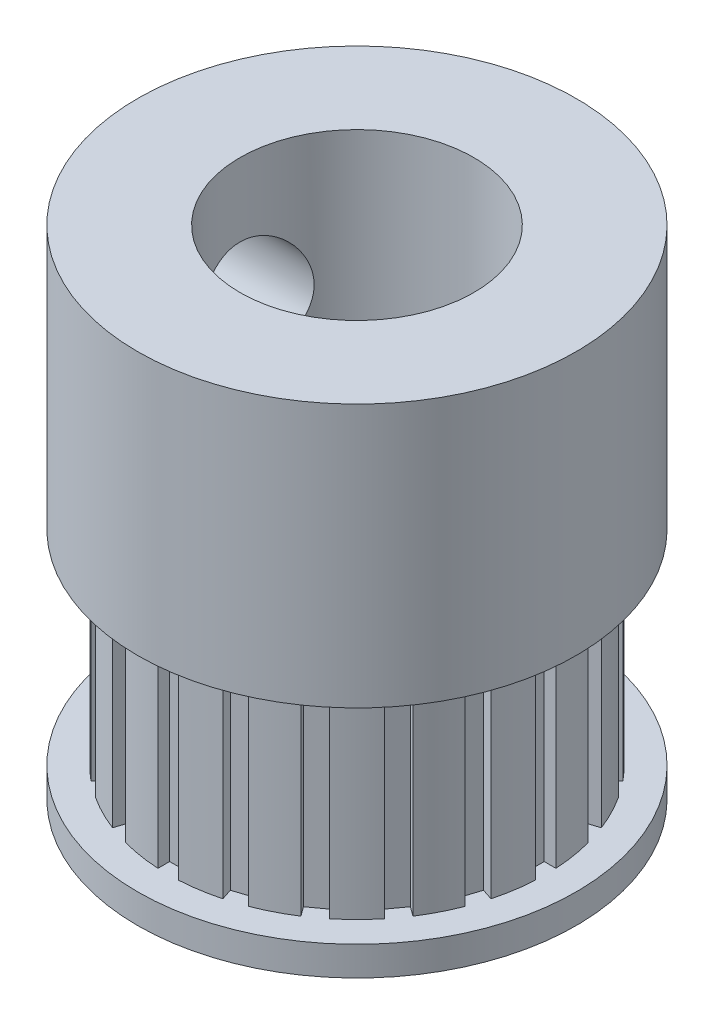
from build123d import *

# Parameters (mm, degrees)
SKETCH_1_R               = 7.5
EXTRUDE_1_DEPTH          = 1
EXTRUDE_2_DEPTH          = 7
SKETCH_3_R               = 7.5
EXTRUDE_3_DEPTH          = 9
CUT_EXTRUDE_1_REACH      = 22.037
SKETCH_4_R               = 4
CUT_EXTRUDE_2_REACH      = 22.037
CUT_EXTRUDE_2_END_RADIUS = 7.5
SKETCH_5_R               = 2


with BuildPart() as part:
    # 草图1 → 凸台-拉伸1 (new body)
    with BuildSketch(Plane(origin=(0, 0, 0), x_dir=(1, 0, 0), z_dir=(0, 1, 0))):
        with Locations(Location((0, 0, 0), (0, 0, 270))):
            Circle(SKETCH_1_R)
    extrude(amount=EXTRUDE_1_DEPTH)

    # 草图2 → 凸台-拉伸2 (add)
    with BuildSketch(Plane(origin=(0, 1, 0), x_dir=(1, 0, 0), z_dir=(0, 1, 0))):
        with BuildLine():
            Line((-0.35, 6.055518957), (-0.35, 6.455518957))
            ThreePointArc((-0.35, 6.455518957), (-1.011348816, 6.385405122), (-1.661995284, 6.247719318))
            Line((-1.661995284, 6.247719318), (-1.538388487, 5.867296711))
            Line((-1.538388487, 5.867296711), (-2.204128048, 5.650984815))
            Line((-2.204128048, 5.650984815), (-2.327734846, 6.031407422))
            ThreePointArc((-2.327734846, 6.031407422), (-2.935048581, 5.760357179), (-3.511302891, 5.428349382))
            Line((-3.511302891, 5.428349382), (-3.27618879, 5.104742584))
            Line((-3.27618879, 5.104742584), (-3.842500686, 4.693292907))
            Line((-3.842500686, 4.693292907), (-4.077614787, 5.016899705))
            ThreePointArc((-4.077614787, 5.016899705), (-4.57144534, 4.57144534), (-5.016899705, 4.077614787))
            Line((-5.016899705, 4.077614787), (-4.693292907, 3.842500686))
            Line((-4.693292907, 3.842500686), (-5.104742584, 3.27618879))
            Line((-5.104742584, 3.27618879), (-5.428349382, 3.511302891))
            ThreePointArc((-5.428349382, 3.511302891), (-5.760357179, 2.935048581), (-6.031407422, 2.327734846))
            Line((-6.031407422, 2.327734846), (-5.650984815, 2.204128048))
            Line((-5.650984815, 2.204128048), (-5.867296711, 1.538388487))
            Line((-5.867296711, 1.538388487), (-6.247719318, 1.661995284))
            ThreePointArc((-6.247719318, 1.661995284), (-6.385405122, 1.011348816), (-6.455518957, 0.35))
            Line((-6.455518957, 0.35), (-6.055518957, 0.35))
            Line((-6.055518957, 0.35), (-6.055518957, -0.35))
            Line((-6.055518957, -0.35), (-6.455518957, -0.35))
            ThreePointArc((-6.455518957, -0.35), (-6.385405122, -1.011348816), (-6.247719318, -1.661995284))
            Line((-6.247719318, -1.661995284), (-5.867296711, -1.538388487))
            Line((-5.867296711, -1.538388487), (-5.650984815, -2.204128048))
            Line((-5.650984815, -2.204128048), (-6.031407422, -2.327734846))
            ThreePointArc((-6.031407422, -2.327734846), (-5.760357179, -2.935048581), (-5.428349382, -3.511302891))
            Line((-5.428349382, -3.511302891), (-5.104742584, -3.27618879))
            Line((-5.104742584, -3.27618879), (-4.693292907, -3.842500686))
            Line((-4.693292907, -3.842500686), (-5.016899705, -4.077614787))
            ThreePointArc((-5.016899705, -4.077614787), (-4.57144534, -4.57144534), (-4.077614787, -5.016899705))
            Line((-4.077614787, -5.016899705), (-3.842500686, -4.693292907))
            Line((-3.842500686, -4.693292907), (-3.27618879, -5.104742584))
            Line((-3.27618879, -5.104742584), (-3.511302891, -5.428349382))
            ThreePointArc((-3.511302891, -5.428349382), (-2.935048581, -5.760357179), (-2.327734846, -6.031407422))
            Line((-2.327734846, -6.031407422), (-2.204128048, -5.650984815))
            Line((-2.204128048, -5.650984815), (-1.538388487, -5.867296711))
            Line((-1.538388487, -5.867296711), (-1.661995284, -6.247719318))
            ThreePointArc((-1.661995284, -6.247719318), (-1.011348816, -6.385405122), (-0.35, -6.455518957))
            Line((-0.35, -6.455518957), (-0.35, -6.055518957))
            Line((-0.35, -6.055518957), (0.35, -6.055518957))
            Line((0.35, -6.055518957), (0.35, -6.455518957))
            ThreePointArc((0.35, -6.455518957), (1.011348816, -6.385405122), (1.661995284, -6.247719318))
            Line((1.661995284, -6.247719318), (1.538388487, -5.867296711))
            Line((1.538388487, -5.867296711), (2.204128048, -5.650984815))
            Line((2.204128048, -5.650984815), (2.327734846, -6.031407422))
            ThreePointArc((2.327734846, -6.031407422), (2.935048581, -5.760357179), (3.511302891, -5.428349382))
            Line((3.511302891, -5.428349382), (3.27618879, -5.104742584))
            Line((3.27618879, -5.104742584), (3.842500686, -4.693292907))
            Line((3.842500686, -4.693292907), (4.077614787, -5.016899705))
            ThreePointArc((4.077614787, -5.016899705), (4.57144534, -4.57144534), (5.016899705, -4.077614787))
            Line((5.016899705, -4.077614787), (4.693292907, -3.842500686))
            Line((4.693292907, -3.842500686), (5.104742584, -3.27618879))
            Line((5.104742584, -3.27618879), (5.428349382, -3.511302891))
            ThreePointArc((5.428349382, -3.511302891), (5.760357179, -2.935048581), (6.031407422, -2.327734846))
            Line((6.031407422, -2.327734846), (5.650984815, -2.204128048))
            Line((5.650984815, -2.204128048), (5.867296711, -1.538388487))
            Line((5.867296711, -1.538388487), (6.247719318, -1.661995284))
            ThreePointArc((6.247719318, -1.661995284), (6.385405122, -1.011348816), (6.455518957, -0.35))
            Line((6.455518957, -0.35), (6.055518957, -0.35))
            Line((6.055518957, -0.35), (6.055518957, 0.35))
            Line((6.055518957, 0.35), (6.455518957, 0.35))
            ThreePointArc((6.455518957, 0.35), (6.385405122, 1.011348816), (6.247719318, 1.661995284))
            Line((6.247719318, 1.661995284), (5.867296711, 1.538388487))
            Line((5.867296711, 1.538388487), (5.650984815, 2.204128048))
            Line((5.650984815, 2.204128048), (6.031407422, 2.327734846))
            ThreePointArc((6.031407422, 2.327734846), (5.760357179, 2.935048581), (5.428349382, 3.511302891))
            Line((5.428349382, 3.511302891), (5.104742584, 3.27618879))
            Line((5.104742584, 3.27618879), (4.693292907, 3.842500686))
            Line((4.693292907, 3.842500686), (5.016899705, 4.077614787))
            ThreePointArc((5.016899705, 4.077614787), (4.57144534, 4.57144534), (4.077614787, 5.016899705))
            Line((4.077614787, 5.016899705), (3.842500686, 4.693292907))
            Line((3.842500686, 4.693292907), (3.27618879, 5.104742584))
            Line((3.27618879, 5.104742584), (3.511302891, 5.428349382))
            ThreePointArc((3.511302891, 5.428349382), (2.935048581, 5.760357179), (2.327734846, 6.031407422))
            Line((2.327734846, 6.031407422), (2.204128048, 5.650984815))
            Line((2.204128048, 5.650984815), (1.538388487, 5.867296711))
            Line((1.538388487, 5.867296711), (1.661995284, 6.247719318))
            ThreePointArc((1.661995284, 6.247719318), (1.011348816, 6.385405122), (0.35, 6.455518957))
            Line((0.35, 6.455518957), (0.35, 6.055518957))
            Line((0.35, 6.055518957), (-0.35, 6.055518957))
        make_face()
    extrude(amount=EXTRUDE_2_DEPTH)

    # 草图3 → 凸台-拉伸3 (add)
    with BuildSketch(Plane(origin=(0, 8, 0), x_dir=(1, 0, 0), z_dir=(0, 1, 0))):
        with Locations(Location((0, 0, 0), (0, 0, 270))):
            Circle(SKETCH_3_R)
    extrude(amount=EXTRUDE_3_DEPTH)

    # 草图4 → 切除-拉伸1 (cut, up to next)
    with BuildSketch(Plane(origin=(0, 17, 0), x_dir=(1, 0, 0), z_dir=(0, 1, 0)), mode=Mode.PRIVATE) as cut_extrude_1_sk1:
        with Locations(Location((0, 0, 0), (0, 0, 270))):
            Circle(SKETCH_4_R)
    cut_extrude_1_tool1 = extrude(cut_extrude_1_sk1.sketch, amount=-CUT_EXTRUDE_1_REACH, mode=Mode.PRIVATE) & part.part
    add(cut_extrude_1_tool1.solids().sort_by_distance((0, 17, 0))[0], mode=Mode.SUBTRACT)

    # 切除-拉伸2: up to this cylinder (the profile starts inside it)
    cut_extrude_2_end = Plane(origin=(0, 12.5, 0), z_dir=(0, -1, 0)) * Cylinder(CUT_EXTRUDE_2_END_RADIUS, 60.074, mode=Mode.PRIVATE)
    # 草图5 → 切除-拉伸2 (cut, up to the surface)
    with BuildSketch(Plane(origin=(0, 0, 0), x_dir=(0, 0, -1), z_dir=(1, 0, 0)), mode=Mode.PRIVATE) as cut_extrude_2_sk1:
        with Locations((0, 12.5)):
            Circle(SKETCH_5_R)
    cut_extrude_2_tool1 = extrude(cut_extrude_2_sk1.sketch, amount=-CUT_EXTRUDE_2_REACH, mode=Mode.PRIVATE) & cut_extrude_2_end
    add(cut_extrude_2_tool1.solids().sort_by_distance((0, 12.5, 0))[0], mode=Mode.SUBTRACT)


solid = part.part
